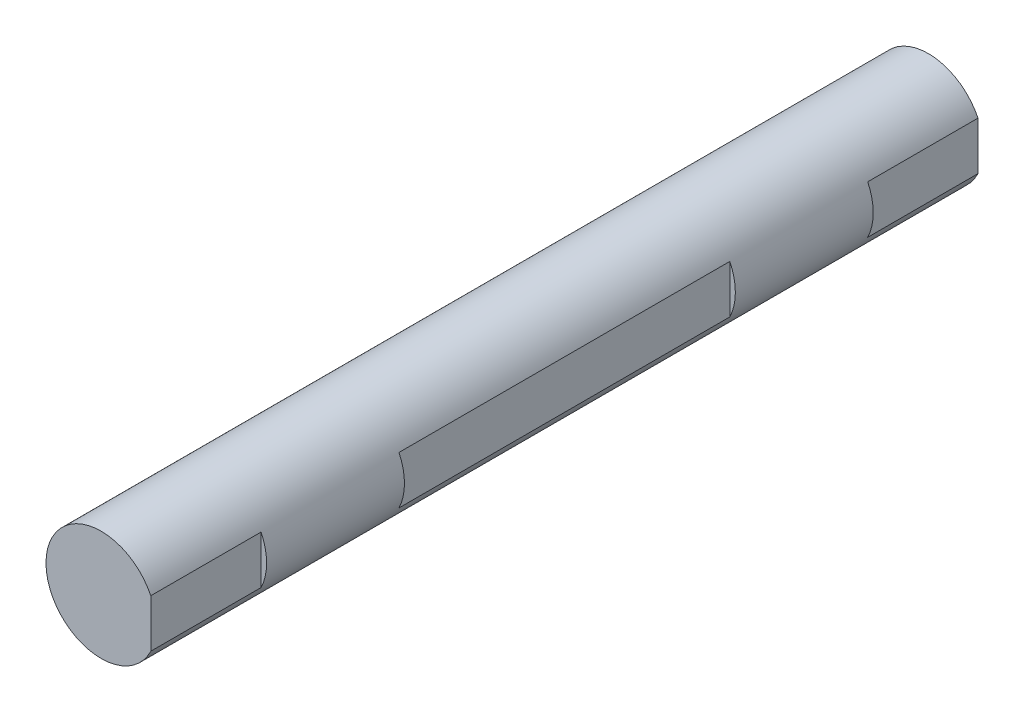
from build123d import *

# Parameters (mm, degrees)
SKETCH_1_R          = 5
EXTRUDE_1_DEPTH     = 75
SKETCH_2_W          = 30
SKETCH_2_H          = 10
SKETCH_2_W_2        = 10
CUT_EXTRUDE_1_DEPTH = 0.5


with BuildPart() as part:
    # 草图1 → 凸台-拉伸1 (new body)
    with BuildSketch(Plane.XY):
        Circle(SKETCH_1_R)
    extrude(amount=EXTRUDE_1_DEPTH)

    # 草图2 → 切除-拉伸1 (cut)
    with BuildSketch(Plane(origin=(5, 0, 0), x_dir=(0, 0, -1), z_dir=(1, 0, 0))):
        with Locations((-37.5, 0)):
            Rectangle(SKETCH_2_W, SKETCH_2_H)
        with Locations((-70, 0)):
            Rectangle(SKETCH_2_W_2, SKETCH_2_H)
        with Locations((-5, 0)):
            Rectangle(SKETCH_2_W_2, SKETCH_2_H)
    extrude(amount=-CUT_EXTRUDE_1_DEPTH, mode=Mode.SUBTRACT)


solid = part.part
